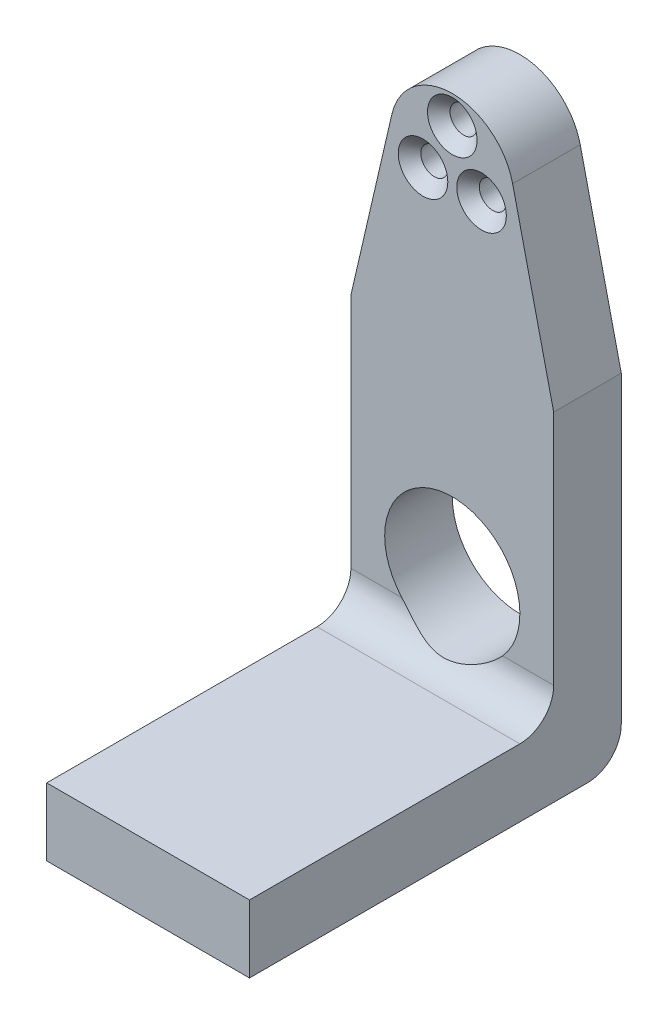
from build123d import *

# Parameters (mm, degrees)
RESSALTO_EXTRUS_O1_DEPTH                             = 6
ESBO_O2_W                                            = 18
ESBO_O2_H                                            = 6
RESSALTO_EXTRUS_O2_DEPTH                             = 27
FILETE1_R                                            = 3
ESBO_O4_R                                            = 6
CORTE_EXTRUS_O1_DEPTH                                = 33
ESCAREADO_PARA_PARAFUSO_DE_M_QUINA_COM_C_D           = 2.4
ESCAREADO_PARA_PARAFUSO_DE_M_QUINA_COM_C_CSINK_D     = 4.4
ESCAREADO_PARA_PARAFUSO_DE_M_QUINA_COM_C_CSINK_ANGLE = 90
PADR_OCIRCULAR1_COUNT                                = 3


with BuildPart() as part:
    # Esboço1 → Ressalto-extrusão1 (new body)
    with BuildSketch(Plane.XY):
        with BuildLine():
            Line((-9, 30), (-9, 0))
            Line((-9, 0), (9, 0))
            Line((9, 0), (9, 30))
            Line((9, 30), (5.358457271, 45.739732099))
            ThreePointArc((5.358457271, 45.739732099), (0, 50), (-5.358457271, 45.739732099))
            Line((-5.358457271, 45.739732099), (-9, 30))
        make_face()
    extrude(amount=RESSALTO_EXTRUS_O1_DEPTH)

    # Esboço2 → Ressalto-extrusão2 (add)
    with BuildSketch(Plane.XY.offset(6)):
        with Locations((0, 3)):
            Rectangle(ESBO_O2_W, ESBO_O2_H)
    extrude(amount=RESSALTO_EXTRUS_O2_DEPTH)

    # Filete1
    filete1_edges = [part.edges().sort_by_distance(p)[0] for p in [
        (0, 6, 6),
        (0, 0, 0),
    ]]
    fillet(filete1_edges, radius=FILETE1_R)

    # Esboço4 → Corte-extrusão1 (cut)
    with BuildSketch(Plane(origin=(0, 0, 0), x_dir=(-1, 0, 0), z_dir=(0, 0, -1))):
        with Locations((0, 13)):
            Circle(ESBO_O4_R)
    extrude(amount=-CORTE_EXTRUS_O1_DEPTH, mode=Mode.SUBTRACT)

    # Escareado para parafuso de máquina com cabeça chata de M22 (through all)
    with Locations(Plane(origin=(0, 47.5, 6), x_dir=(1, 0, 0), z_dir=(0, 0, 1))):
        with Locations((0, 0)):
            escareado_para_parafuso_de_m_quina_com_c = CounterSinkHole(ESCAREADO_PARA_PARAFUSO_DE_M_QUINA_COM_C_D / 2, ESCAREADO_PARA_PARAFUSO_DE_M_QUINA_COM_C_CSINK_D / 2, counter_sink_angle=ESCAREADO_PARA_PARAFUSO_DE_M_QUINA_COM_C_CSINK_ANGLE)

    # PadrãoCircular1: Escareado para parafuso de máquina com cabeça chata de M22 ×3 about axis
    padr_ocircular1_axis = Axis((0, 44.5, 0), (0, 0, 1))
    for i in range(1, PADR_OCIRCULAR1_COUNT):
        add(escareado_para_parafuso_de_m_quina_com_c.rotate(padr_ocircular1_axis, i * 360 / PADR_OCIRCULAR1_COUNT), mode=Mode.SUBTRACT)


solid = part.part
